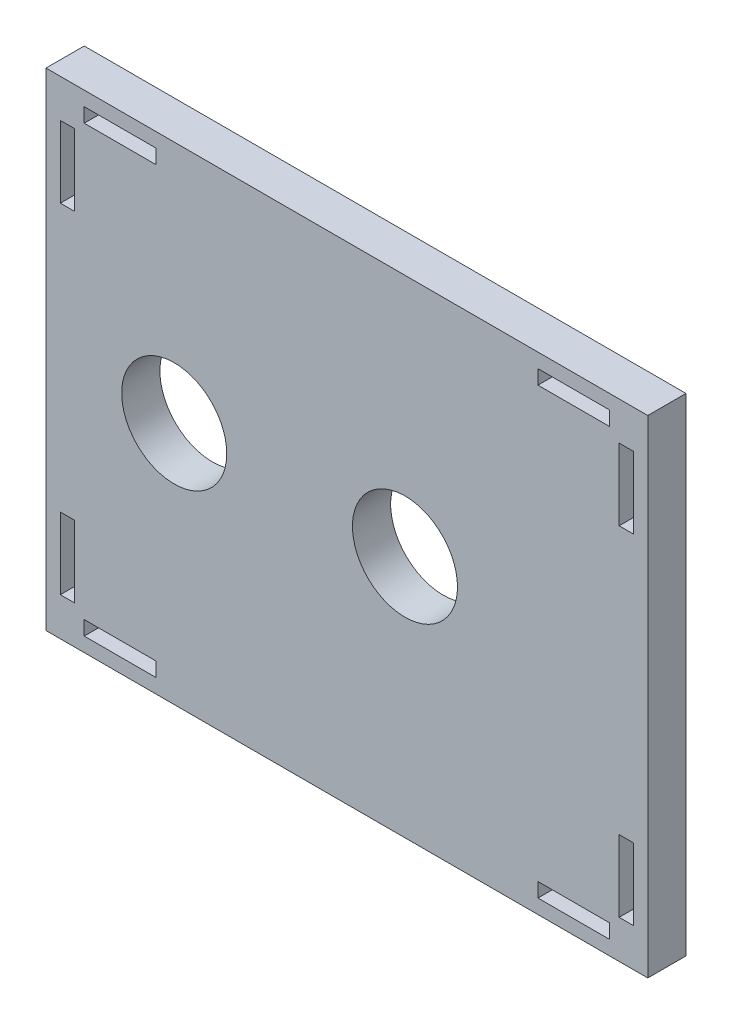
from build123d import *

# Parameters (mm, degrees)
SKETCH1_W           = 126
SKETCH1_H           = 102
SKETCH1_R           = 11
SKETCH1_W_2         = 3
SKETCH1_H_2         = 15
SKETCH1_W_3         = 15
SKETCH1_H_3         = 3
BOSS_EXTRUDE1_DEPTH = 8


with BuildPart() as part:
    # Sketch1 → Boss-Extrude1 (new body)
    with BuildSketch(Plane.XY):
        with Locations((12, 0)):
            Rectangle(SKETCH1_W, SKETCH1_H)
        with Locations((-24.15725, 0)):
            Circle(SKETCH1_R, mode=Mode.SUBTRACT)
        with Locations((24.15725, 0)):
            Circle(SKETCH1_R, mode=Mode.SUBTRACT)
        with Locations((-46.5, -35.5)):
            Rectangle(SKETCH1_W_2, SKETCH1_H_2, mode=Mode.SUBTRACT)
        with Locations((-46.5, 35.5)):
            Rectangle(SKETCH1_W_2, SKETCH1_H_2, mode=Mode.SUBTRACT)
        with Locations((70.5, 35.5)):
            Rectangle(SKETCH1_W_2, SKETCH1_H_2, mode=Mode.SUBTRACT)
        with Locations((70.5, -35.5)):
            Rectangle(SKETCH1_W_2, SKETCH1_H_2, mode=Mode.SUBTRACT)
        with Locations((-35.5, 46.5)):
            Rectangle(SKETCH1_W_3, SKETCH1_H_3, mode=Mode.SUBTRACT)
        with Locations((59.5, 46.5)):
            Rectangle(SKETCH1_W_3, SKETCH1_H_3, mode=Mode.SUBTRACT)
        with Locations((-35.5, -46.5)):
            Rectangle(SKETCH1_W_3, SKETCH1_H_3, mode=Mode.SUBTRACT)
        with Locations((59.5, -46.5)):
            Rectangle(SKETCH1_W_3, SKETCH1_H_3, mode=Mode.SUBTRACT)
    extrude(amount=BOSS_EXTRUDE1_DEPTH)


solid = part.part
